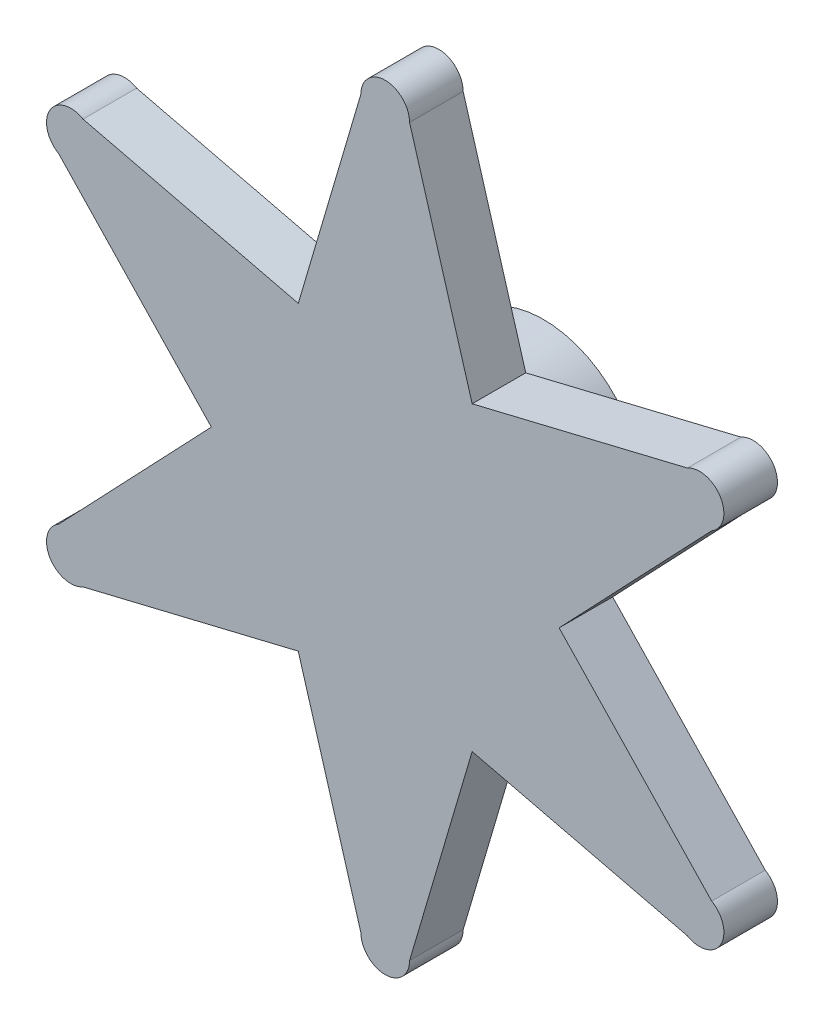
from build123d import *

# Parameters (mm, degrees)
BOSS_EXTRUDE1_DEPTH      = 0.5
BOSS_EXTRUDE1_DEPTH_BACK = 3.8
SKETCH1_R                = 4.045391251
BOSS_EXTRUDE2_DEPTH      = 2.2


with BuildPart() as part:
    # Sketch1 → Boss-Extrude1 (new, two sides: drawn at the far end of the back side and taken through both)
    with BuildSketch(Plane.XY.offset(-BOSS_EXTRUDE1_DEPTH_BACK)):
        with Locations((11.194571019, 0)):
            Circle(SKETCH1_R)
        Polygon((11.107150515, 2.798634963), (11.010910914, 2.936063183), (10.932654514, 2.787656605), (10.827975631, 2.918770707), (10.759192179, 2.765743216), (10.646487133, 2.890025753), (10.587448085, 2.732981278), (10.467161672, 2.849941763), (10.418100028, 2.689500087), (10.290706963, 2.798676931), (10.251816347, 2.635471244), (10.117819392, 2.736433576), (10.089253288, 2.571107976), (9.949181268, 2.663457343), (9.931052413, 2.496664295), (9.785458129, 2.580036237), (9.777838069, 2.412433996), (9.627296114, 2.486499482), (9.630214922, 2.318749499), (9.475319417, 2.383216226), (9.488765575, 2.215980532), (9.330127821, 2.27059408), (9.354048262, 2.104532679), (9.192294331, 2.149077512), (9.226594652, 1.984845772), (9.062362912, 2.019146093), (9.106907745, 1.857392162), (8.940846344, 1.881312602), (8.995459891, 1.722674849), (8.828224198, 1.736121006), (8.892690925, 1.581225501), (8.724940941, 1.58414431), (8.799006427, 1.433602355), (8.631404187, 1.425982295), (8.714776129, 1.280388011), (8.547983081, 1.262259155), (8.640332448, 1.122187136), (8.475006848, 1.093621032), (8.57596918, 0.959624077), (8.412763492, 0.920733461), (8.521940337, 0.793340396), (8.36149866, 0.744278752), (8.478459146, 0.623992339), (8.321414671, 0.564953291), (8.445697208, 0.452248245), (8.292669717, 0.383464792), (8.423783819, 0.278785909), (8.275377241, 0.20052951), (8.412805461, 0.104289909), (8.26960549, 0.016869405), (8.412805461, -0.0705511), (8.275377241, -0.166790701), (8.423783819, -0.2450471), (8.292669717, -0.349725983), (8.445697208, -0.418509436), (8.321414671, -0.531214482), (8.478459146, -0.59025353), (8.36149866, -0.710539943), (8.521940337, -0.759601587), (8.412763492, -0.886994652), (8.57596918, -0.925885268), (8.475006848, -1.059882223), (8.640332448, -1.088448327), (8.547983081, -1.228520346), (8.714776129, -1.246649202), (8.631404187, -1.392243486), (8.799006427, -1.399863546), (8.724940941, -1.550405501), (8.892690925, -1.547486692), (8.828224198, -1.702382197), (8.995459891, -1.68893604), (8.940846344, -1.847573793), (9.106907745, -1.823653353), (9.062362912, -1.985407284), (9.226594652, -1.951106963), (9.192294331, -2.115338703), (9.354048262, -2.07079387), (9.330127821, -2.236855271), (9.488765575, -2.182241723), (9.475319417, -2.349477417), (9.630214922, -2.28501069), (9.627296114, -2.452760673), (9.777838069, -2.378695187), (9.785458129, -2.546297428), (9.931052413, -2.462925486), (9.949181268, -2.629718534), (10.089253288, -2.537369167), (10.117819392, -2.702694767), (10.251816347, -2.601732435), (10.290706963, -2.764938122), (10.418100028, -2.655761278), (10.467161672, -2.816202954), (10.587448085, -2.699242469), (10.646487133, -2.856286944), (10.759192179, -2.732004407), (10.827975631, -2.885031898), (10.932654514, -2.753917796), (11.010910914, -2.902324374), (11.107150515, -2.764896154), (11.194571019, -2.908096125), (11.281991524, -2.764896154), (11.378231124, -2.902324374), (11.456487524, -2.753917796), (11.561166407, -2.885031898), (11.629949859, -2.732004407), (11.742654905, -2.856286944), (11.801693953, -2.699242469), (11.921980367, -2.816202954), (11.971042011, -2.655761278), (12.098435076, -2.764938122), (12.137325692, -2.601732435), (12.271322646, -2.702694767), (12.29988875, -2.537369167), (12.43996077, -2.629718534), (12.458089625, -2.462925486), (12.60368391, -2.546297428), (12.611303969, -2.378695187), (12.761845924, -2.452760673), (12.758927116, -2.28501069), (12.913822621, -2.349477417), (12.900376463, -2.182241723), (13.059014217, -2.236855271), (13.035093776, -2.07079387), (13.196847707, -2.115338703), (13.162547387, -1.951106963), (13.326779126, -1.985407284), (13.282234293, -1.823653353), (13.448295694, -1.847573793), (13.393682147, -1.68893604), (13.56091784, -1.702382197), (13.496451114, -1.547486692), (13.664201097, -1.550405501), (13.590135611, -1.399863546), (13.757737852, -1.392243486), (13.674365909, -1.246649202), (13.841158958, -1.228520346), (13.74880959, -1.088448327), (13.91413519, -1.059882223), (13.813172859, -0.925885268), (13.976378546, -0.886994652), (13.867201702, -0.759601587), (14.027643378, -0.710539943), (13.910682893, -0.59025353), (14.067727368, -0.531214482), (13.943444831, -0.418509436), (14.096472322, -0.349725983), (13.96535822, -0.2450471), (14.113764797, -0.166790701), (13.976336578, -0.0705511), (14.119536549, 0.016869405), (13.976336578, 0.104289909), (14.113764797, 0.20052951), (13.96535822, 0.278785909), (14.096472322, 0.383464792), (13.943444831, 0.452248245), (14.067727368, 0.564953291), (13.910682893, 0.623992339), (14.027643378, 0.744278752), (13.867201702, 0.793340396), (13.976378546, 0.920733461), (13.813172859, 0.959624077), (13.91413519, 1.093621032), (13.74880959, 1.122187136), (13.841158958, 1.262259155), (13.674365909, 1.280388011), (13.757737852, 1.425982295), (13.590135611, 1.433602355), (13.664201097, 1.58414431), (13.496451114, 1.581225501), (13.56091784, 1.736121006), (13.393682147, 1.722674849), (13.448295694, 1.881312602), (13.282234293, 1.857392162), (13.326779126, 2.019146093), (13.162547387, 1.984845772), (13.196847707, 2.149077512), (13.035093776, 2.104532679), (13.059014217, 2.27059408), (12.900376463, 2.215980532), (12.913822621, 2.383216226), (12.758927116, 2.318749499), (12.761845924, 2.486499482), (12.611303969, 2.412433996), (12.60368391, 2.580036237), (12.458089625, 2.496664295), (12.43996077, 2.663457343), (12.29988875, 2.571107976), (12.271322646, 2.736433576), (12.137325692, 2.635471244), (12.098435076, 2.798676931), (11.971042011, 2.689500087), (11.921980367, 2.849941763), (11.801693953, 2.732981278), (11.742654905, 2.890025753), (11.629949859, 2.765743216), (11.561166407, 2.918770707), (11.456487524, 2.787656605), (11.378231124, 2.936063183), (11.281991524, 2.798634963), (11.194571019, 2.941834934), align=None, mode=Mode.SUBTRACT)
    extrude(amount=BOSS_EXTRUDE1_DEPTH + BOSS_EXTRUDE1_DEPTH_BACK)

    # Sketch3 → Boss-Extrude2 (add)
    with BuildSketch(Plane.XY.offset(0.5)):
        with BuildLine():
            Line((7.624378982, 6.079163496), (10.194571019, 14.8))
            ThreePointArc((10.194571019, 14.8), (11.194571019, 15.8), (12.194571019, 14.8))
            Line((12.194571019, 14.8), (14.764763057, 6.079163496))
            Line((14.764763057, 6.079163496), (23.60232503, 8.213730151))
            ThreePointArc((23.60232503, 8.213730151), (24.968350434, 7.847704747), (24.60232503, 6.481679344))
            Line((24.60232503, 6.481679344), (18.334955094, -0.104590505))
            Line((18.334955094, -0.104590505), (24.60232503, -6.690860354))
            ThreePointArc((24.60232503, -6.690860354), (24.968350434, -8.056885758), (23.60232503, -8.422911162))
            Line((23.60232503, -8.422911162), (14.764763057, -6.288344507))
            Line((14.764763057, -6.288344507), (12.194571019, -15.009181011))
            ThreePointArc((12.194571019, -15.009181011), (11.194571019, -16.009181011), (10.194571019, -15.009181011))
            Line((10.194571019, -15.009181011), (7.624378982, -6.288344507))
            Line((7.624378982, -6.288344507), (-1.213182991, -8.422911162))
            ThreePointArc((-1.213182991, -8.422911162), (-2.579208395, -8.056885758), (-2.213182991, -6.690860354))
            Line((-2.213182991, -6.690860354), (4.054186944, -0.104590505))
            Line((4.054186944, -0.104590505), (-2.213182991, 6.481679344))
            ThreePointArc((-2.213182991, 6.481679344), (-2.579208395, 7.847704747), (-1.213182991, 8.213730151))
            Line((-1.213182991, 8.213730151), (7.624378982, 6.079163496))
        make_face()
    extrude(amount=BOSS_EXTRUDE2_DEPTH)


solid = part.part
